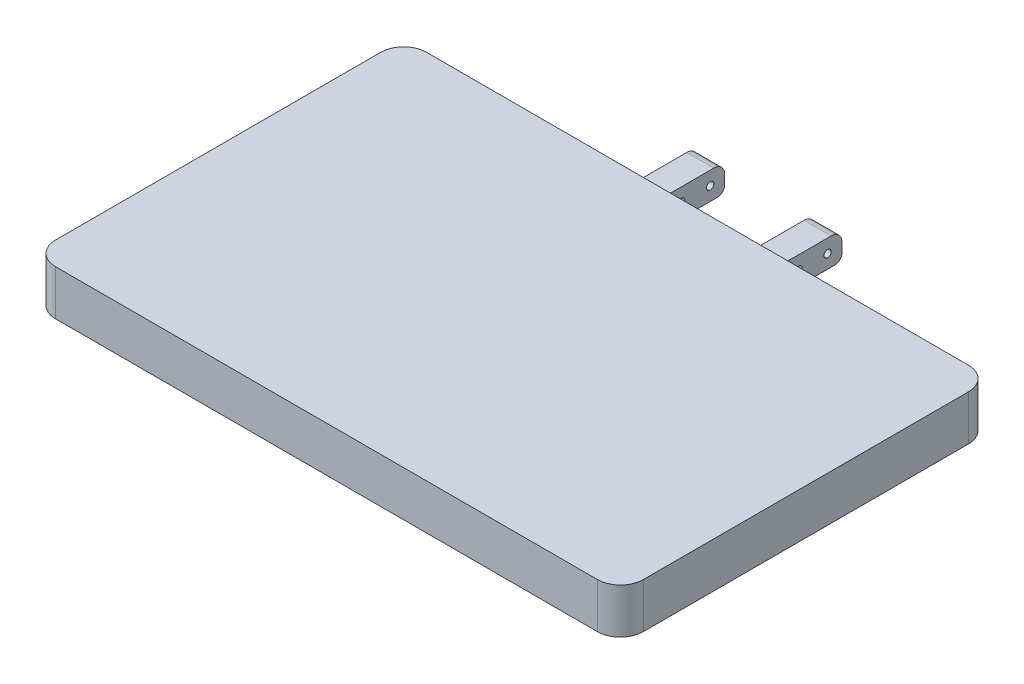
from build123d import *

# Parameters (mm, degrees)
BOSS_EXTRUDE1_DEPTH     = 31.75
SHELL1_T                = -7.62
SKETCH1_5_W             = 101.6
SKETCH1_5_H             = 50.8
BOSS_EXTRUDE3_DEPTH     = 19.05
CUT_EXTRUDE2_DEPTH      = 506.280856772
CUT_EXTRUDE2_DEPTH_BACK = 506.280856772
SKETCH4_W               = 63.5
SKETCH4_H               = 50.8
FILLET5_R               = 7.62
FILLET6_R               = 5.08
FILLET7_R               = 7.62
FILLET8_R               = 5.08
FILLET9_R               = 5.08
FILLET10_R              = 5.08
FILLET11_R              = 2.54
FILLET12_R              = 2.54
FILLET13_R              = 2.54
FILLET14_R              = 2.54
CUT_EXTRUDE3_DEPTH      = 406.583478584
CUT_EXTRUDE3_DEPTH_BACK = 406.583478584
SKETCH5_R               = 2.54


with BuildPart() as part:
    # Sketch1 → Boss-Extrude1 (new body)
    with BuildSketch(Plane(origin=(0, 0, 0), x_dir=(1, 0, 0), z_dir=(0, 1, 0))):
        with BuildLine():
            ThreePointArc((-16.1798, 16.1798), (-11.440846298, 4.738953702), (0, 0))
            Line((0, 0), (381, 0))
            ThreePointArc((381, 0), (392.440846298, 4.738953702), (397.1798, 16.1798))
            Line((397.1798, 16.1798), (397.1798, 244.7798))
            ThreePointArc((397.1798, 244.7798), (392.440846298, 256.220646298), (381, 260.9596))
            Line((381, 260.9596), (241.3, 260.9596))
            Line((241.3, 260.9596), (139.7, 260.9596))
            Line((139.7, 260.9596), (0, 260.9596))
            ThreePointArc((0, 260.9596), (-11.440846298, 256.220646298), (-16.1798, 244.7798))
            Line((-16.1798, 244.7798), (-16.1798, 16.1798))
        make_face()
    extrude(amount=BOSS_EXTRUDE1_DEPTH)

    # Shell1
    shell1_openings = [part.faces().sort_by_distance(p)[0] for p in [
        (190.5, 0, -130.4798),
    ]]
    offset(amount=SHELL1_T, openings=shell1_openings, kind=Kind.INTERSECTION)

    # Sketch1<5> → Boss-Extrude3 (add)
    with BuildSketch(Plane(origin=(0, 0, 0), x_dir=(1, 0, 0), z_dir=(0, 1, 0))):
        with Locations((190.5, 286.3596)):
            Rectangle(SKETCH1_5_W, SKETCH1_5_H)
    extrude(amount=BOSS_EXTRUDE3_DEPTH)

    # Sketch4 → Cut-Extrude2 (cut, two sides: drawn at the far end of the back side and taken through both)
    with BuildSketch(Plane(origin=(0, 19.05, 0), x_dir=(1, 0, 0), z_dir=(0, 1, 0)).offset(-CUT_EXTRUDE2_DEPTH_BACK)):
        with Locations((190.5, 286.3596)):
            Rectangle(SKETCH4_W, SKETCH4_H)
    extrude(amount=CUT_EXTRUDE2_DEPTH + CUT_EXTRUDE2_DEPTH_BACK, mode=Mode.SUBTRACT)

    # Fillet5
    fillet5_edges = [part.edges().sort_by_distance(p)[0] for p in [
        (231.775, 19.05, -311.7596),
    ]]
    fillet(fillet5_edges, radius=FILLET5_R)

    # Fillet6
    fillet6_edges = [part.edges().sort_by_distance(p)[0] for p in [
        (231.775, 0, -311.7596),
    ]]
    fillet(fillet6_edges, radius=FILLET6_R)

    # Fillet7
    fillet7_edges = [part.edges().sort_by_distance(p)[0] for p in [
        (149.225, 19.05, -311.7596),
    ]]
    fillet(fillet7_edges, radius=FILLET7_R)

    # Fillet8
    fillet8_edges = [part.edges().sort_by_distance(p)[0] for p in [
        (149.225, 0, -311.7596),
    ]]
    fillet(fillet8_edges, radius=FILLET8_R)

    # Fillet9
    fillet9_edges = [part.edges().sort_by_distance(p)[0] for p in [
        (231.775, 19.05, -260.9596),
    ]]
    fillet(fillet9_edges, radius=FILLET9_R)

    # Fillet10
    fillet10_edges = [part.edges().sort_by_distance(p)[0] for p in [
        (149.225, 19.05, -260.9596),
    ]]
    fillet(fillet10_edges, radius=FILLET10_R)

    # Fillet11
    fillet11_edges = [part.edges().sort_by_distance(p)[0] for p in [
        (241.3, 12.065, -260.9596),
    ]]
    fillet(fillet11_edges, radius=FILLET11_R)

    # Fillet12
    fillet12_edges = [part.edges().sort_by_distance(p)[0] for p in [
        (222.25, 12.065, -260.9596),
    ]]
    fillet(fillet12_edges, radius=FILLET12_R)

    # Fillet13
    fillet13_edges = [part.edges().sort_by_distance(p)[0] for p in [
        (158.75, 12.065, -260.9596),
    ]]
    fillet(fillet13_edges, radius=FILLET13_R)

    # Fillet14
    fillet14_edges = [part.edges().sort_by_distance(p)[0] for p in [
        (139.7, 12.065, -260.9596),
    ]]
    fillet(fillet14_edges, radius=FILLET14_R)

    # Sketch5 → Cut-Extrude3 (cut, two sides: drawn at the far end of the back side and taken through both)
    with BuildSketch(Plane(origin=(241.3, 0, 0), x_dir=(0, 0, -1), z_dir=(1, 0, 0)).offset(-CUT_EXTRUDE3_DEPTH_BACK)):
        with Locations((301.5996, 9.525)):
            Circle(SKETCH5_R)
        with Locations((281.2796, 9.525)):
            Circle(SKETCH5_R)
    extrude(amount=CUT_EXTRUDE3_DEPTH + CUT_EXTRUDE3_DEPTH_BACK, mode=Mode.SUBTRACT)


solid = part.part
